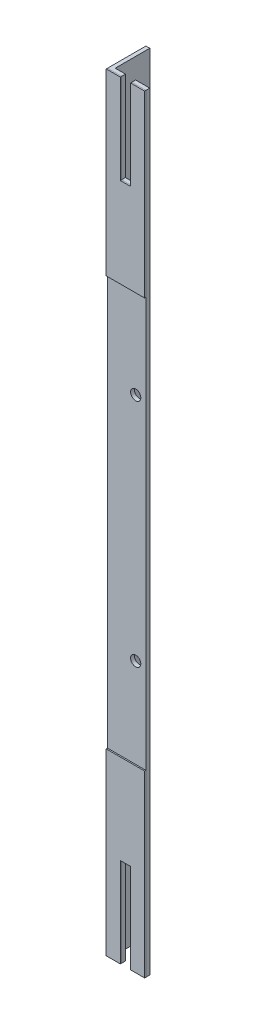
from build123d import *

# Parameters (mm, degrees)
EXTRU_MINCE1_DEPTH      = 300
ESQUISSE2_R             = 4
ESQUISSE2_W             = 8
ESQUISSE2_H             = 70
ENL_V_MAT_EXTRU_1_DEPTH = 303.985148151
BOSS_EXTRU_1_DEPTH      = 1
BOSS_EXTRU_1_2_DEPTH    = 1


with BuildPart() as part:
    # Esquisse1 → Extru.-Mince1 (new, symmetric)
    with BuildSketch(Plane(origin=(0, 0, 0), x_dir=(1, 0, 0), z_dir=(0, 1, 0))):
        Polygon((0, 30), (0, 0), (30, 0), (30, 3), (3, 3), (3, 30), align=None)
    extrude(amount=EXTRU_MINCE1_DEPTH, both=True)

    # Esquisse2 → Enlèv. mat.-Extru.1 (cut, through all)
    with BuildSketch(Plane.XY):
        with Locations((22, 90)):
            Circle(ESQUISSE2_R)
        with Locations(Location((22, -90, 0), (0, 0, 180))):
            Circle(ESQUISSE2_R)
        with Locations((15, 265)):
            Rectangle(ESQUISSE2_W, ESQUISSE2_H)
        with Locations((15, -265)):
            Rectangle(ESQUISSE2_W, ESQUISSE2_H)
    extrude(amount=-ENL_V_MAT_EXTRU_1_DEPTH, mode=Mode.SUBTRACT)


with BuildPart() as body_2:
    # Esquisse3 → Boss.-Extru.1 (new body)
    with BuildSketch(Plane.XY):
        Polygon((0, 160), (30, 160), (30, 300), (19, 300), (19, 230), (11, 230), (11, 300), (0, 300), align=None)
    extrude(amount=BOSS_EXTRU_1_DEPTH)


with BuildPart() as body_3:
    # Esquisse3 → Boss.-Extru.1 2 (new body)
    with BuildSketch(Plane.XY):
        Polygon((0, -160), (0, -300), (11, -300), (11, -230), (19, -230), (19, -300), (30, -300), (30, -160), align=None)
    extrude(amount=BOSS_EXTRU_1_2_DEPTH)


solid = Compound([part.part, body_2.part, body_3.part])
